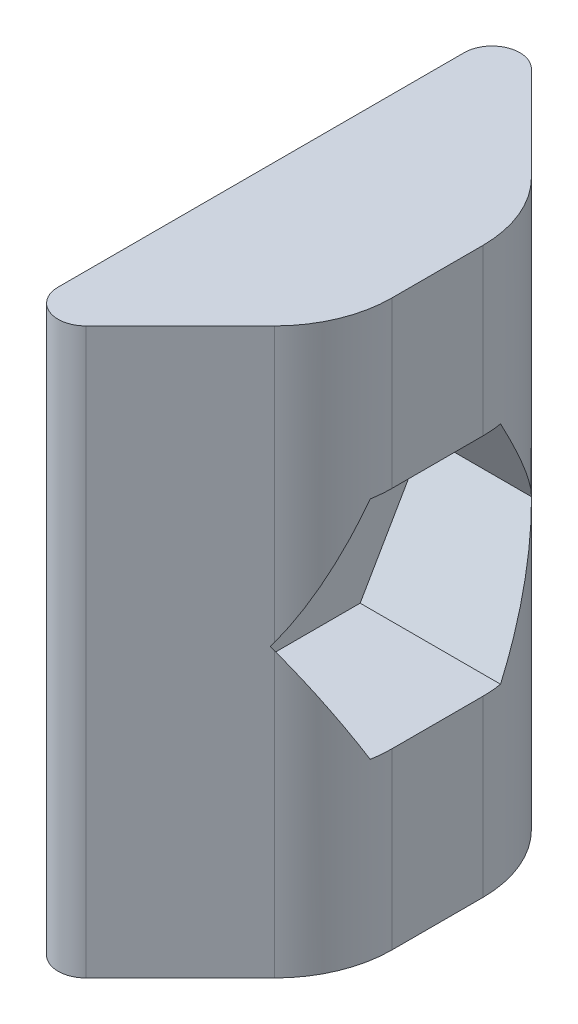
from build123d import *

# Parameters (mm, degrees)
BOSS_EXTRUDE1_START = 2.6
BOSS_EXTRUDE1_DEPTH = 7
CUT_EXTRUDE1_START  = -0.8
CUT_EXTRUDE1_DEPTH  = 10
SKETCH3_R           = 1.75
CUT_EXTRUDE2_DEPTH  = 5


with BuildPart() as part:
    # Sketch1 → Boss-Extrude1 (new, symmetric)
    with BuildSketch(Plane(origin=(0, 887.368143731, 0), x_dir=(1, 0, 0), z_dir=(0, 1, 0)).offset(BOSS_EXTRUDE1_START)):
        with BuildLine():
            Line((633.443700104, -1269.972215541), (633.443700891, -1272.141337124))
            ThreePointArc((633.443700891, -1272.141337124), (633.869649439, -1272.778813799), (634.62160457, -1272.629240553))
            Line((634.62160457, -1272.629240553), (636.9613816, -1270.289463523))
            ThreePointArc((636.9613816, -1270.289463523), (637.592190307, -1269.345391575), (637.813700867, -1268.231782784))
            Line((637.813700867, -1268.231782784), (637.813700862, -1265.982648565))
            ThreePointArc((637.813700862, -1265.982648565), (637.5921903, -1264.86903978), (636.961381595, -1263.924967838))
            Line((636.961381595, -1263.924967838), (634.621604564, -1261.585190807))
            ThreePointArc((634.621604564, -1261.585190807), (633.869649432, -1261.435617561), (633.443700885, -1262.073094238))
            Line((633.443700885, -1262.073094238), (633.443700104, -1264.242215823))
            Line((633.443700104, -1264.242215823), (633.443700104, -1269.972215541))
        make_face()
    extrude(amount=BOSS_EXTRUDE1_DEPTH, both=True)

    # Sketch2 → Cut-Extrude1 (cut)
    with BuildSketch(Plane.ZY.offset(-633.493700104).offset(CUT_EXTRUDE1_START)):
        Polygon((1268.73001891, 887.288143731), (1268.795260282, 887.4011451), (1270.343712913, 890.083143731), (1268.73001891, 892.878143731), (1265.502630906, 892.878143731), (1265.437389534, 892.765142361), (1263.888936903, 890.083143731), (1265.502630906, 887.288143731), align=None)
    extrude(amount=-CUT_EXTRUDE1_DEPTH, mode=Mode.SUBTRACT)

    # Sketch3 → Cut-Extrude2 (cut, symmetric)
    with BuildSketch(Plane.ZY.offset(-633.493700104)):
        with Locations((1267.116324916, 890.083143731)):
            Circle(SKETCH3_R)
    extrude(amount=CUT_EXTRUDE2_DEPTH, both=True, mode=Mode.SUBTRACT)


solid = part.part
